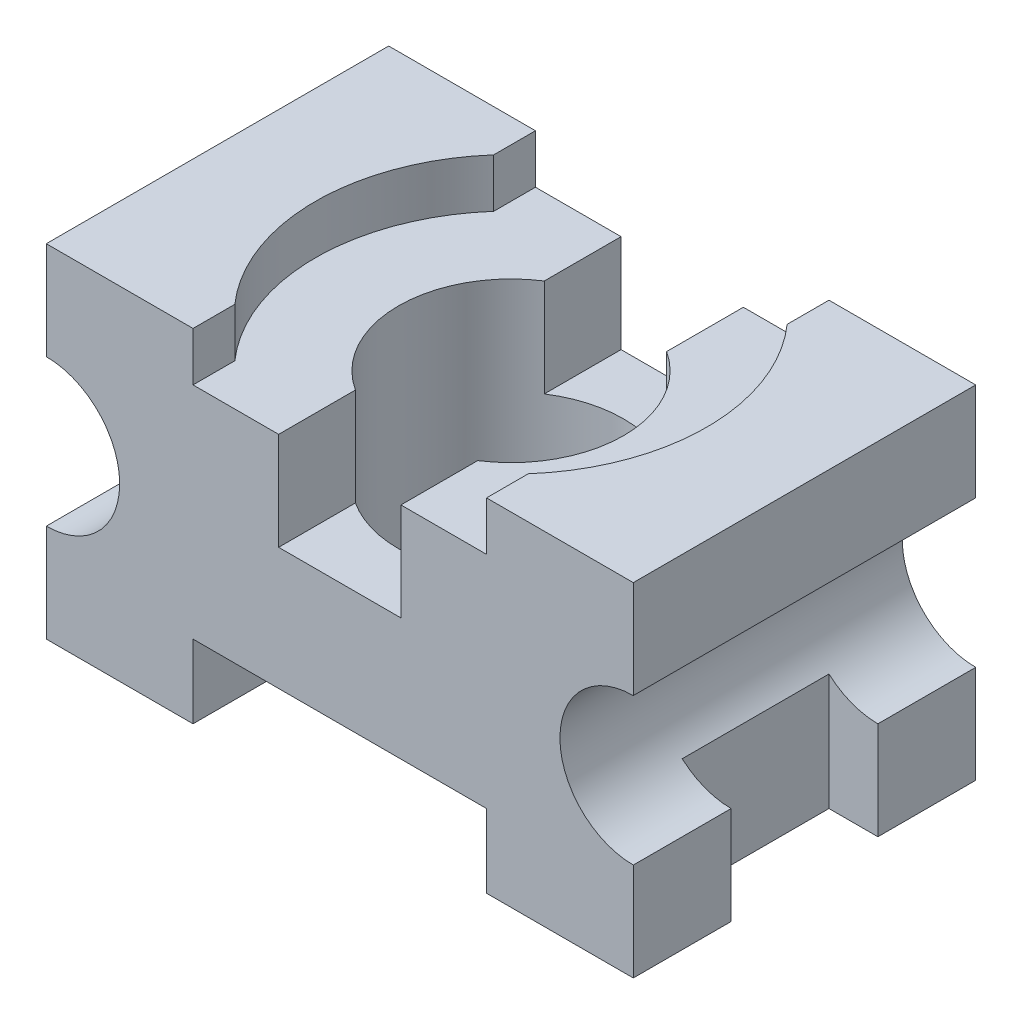
from build123d import *

# Parameters (mm, degrees)
BOSS_EXTRUDE1_DEPTH = 70
SKETCH2_R           = 40
CUT_EXTRUDE1_DEPTH  = 10
SKETCH3_R           = 23
CUT_EXTRUDE2_DEPTH  = 66
SKETCH4_W           = 30
SKETCH4_H           = 15
SKETCH4_H_2         = 20
CUT_EXTRUDE3_DEPTH  = 10


with BuildPart() as part:
    # Sketch1 → Boss-Extrude1 (new body)
    with BuildSketch(Plane.XY):
        with BuildLine():
            Line((-60.063092464, -25.71543861), (-60.063092464, -45.71543861))
            Line((-60.063092464, -45.71543861), (-30.063092464, -45.71543861))
            Line((-30.063092464, -45.71543861), (-30.063092464, -30.71543861))
            Line((-30.063092464, -30.71543861), (29.936907536, -30.71543861))
            Line((29.936907536, -30.71543861), (29.936907536, -45.71543861))
            Line((29.936907536, -45.71543861), (59.936907536, -45.71543861))
            Line((59.936907536, -45.71543861), (59.936907536, -25.71543861))
            ThreePointArc((59.936907536, -25.71543861), (44.936907536, -10.71543861), (59.936907536, 4.28456139))
            Line((59.936907536, 4.28456139), (59.936907536, 24.28456139))
            Line((59.936907536, 24.28456139), (29.936907536, 24.28456139))
            Line((29.936907536, 24.28456139), (29.936907536, 14.28456139))
            Line((29.936907536, 14.28456139), (12.436907536, 14.28456139))
            Line((12.436907536, 14.28456139), (12.436907536, -5.71543861))
            Line((12.436907536, -5.71543861), (-12.563092464, -5.71543861))
            Line((-12.563092464, -5.71543861), (-12.563092464, 14.28456139))
            Line((-12.563092464, 14.28456139), (-30.063092464, 14.28456139))
            Line((-30.063092464, 14.28456139), (-30.063092464, 24.28456139))
            Line((-30.063092464, 24.28456139), (-60.063092464, 24.28456139))
            Line((-60.063092464, 24.28456139), (-60.063092464, 4.28456139))
            ThreePointArc((-60.063092464, 4.28456139), (-45.063092464, -10.71543861), (-60.063092464, -25.71543861))
        make_face()
    extrude(amount=BOSS_EXTRUDE1_DEPTH)

    # Sketch2 → Cut-Extrude1 (cut)
    with BuildSketch(Plane(origin=(0, 24.28456139, 0), x_dir=(1, 0, 0), z_dir=(0, 1, 0))):
        with Locations((-0.063092464, -35)):
            Circle(SKETCH2_R)
    extrude(amount=-CUT_EXTRUDE1_DEPTH, mode=Mode.SUBTRACT)

    # Sketch3 → Cut-Extrude2 (cut)
    with BuildSketch(Plane(origin=(0, 14.28456139, 0), x_dir=(1, 0, 0), z_dir=(0, 1, 0))):
        with Locations(Location((-0.063092464, -35, 0), (0, 0, 270))):
            Circle(SKETCH3_R)
    extrude(amount=-CUT_EXTRUDE2_DEPTH, mode=Mode.SUBTRACT)

    # Sketch4 → Cut-Extrude3 (cut)
    with BuildSketch(Plane.ZY.offset(60.063092464)):
        with Locations((35, -18.21543861)):
            Rectangle(SKETCH4_W, SKETCH4_H)
        with Locations((35, -35.71543861)):
            Rectangle(SKETCH4_W, SKETCH4_H_2)
    cut_extrude3 = extrude(amount=-CUT_EXTRUDE3_DEPTH, mode=Mode.SUBTRACT)

    # Mirror1: Cut-Extrude3 across plane
    add(cut_extrude3.mirror(Plane.ZY.offset(0.063092464)), mode=Mode.SUBTRACT)


solid = part.part
